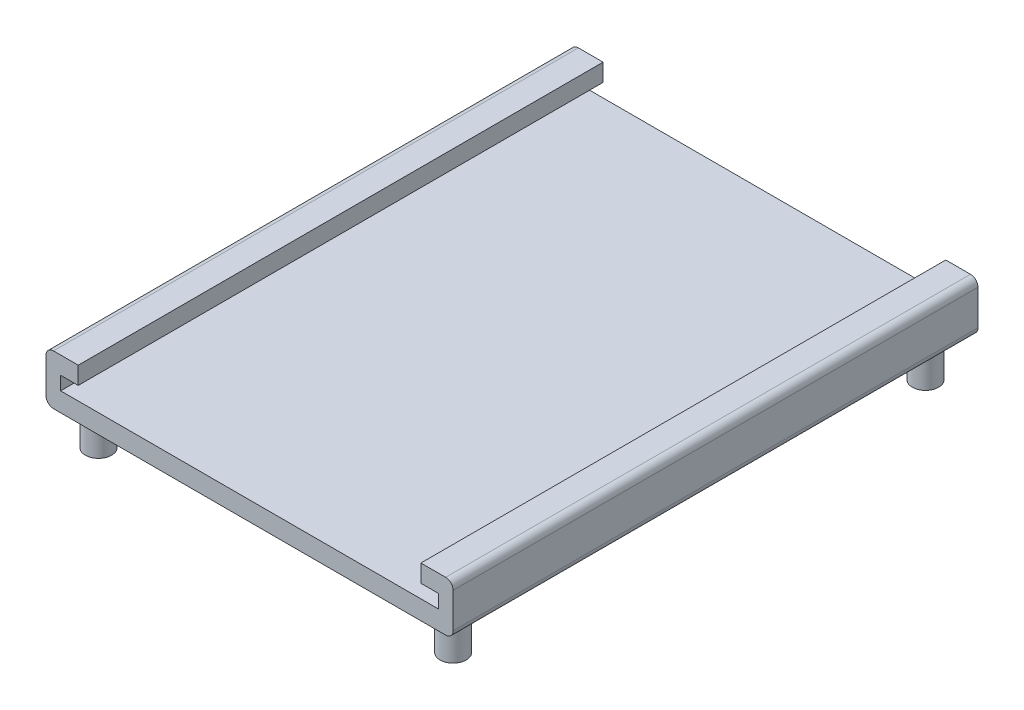
from build123d import *

# Parameters (mm, degrees)
SKETCH1_W             = 50
SKETCH1_H             = 70
BOSS_EXTRUDE1_DEPTH   = 2.54
SKETCH2_W             = 2.15
SKETCH2_H             = 70
BOSS_EXTRUDE2_DEPTH   = 2.54
BOSS_EXTRUDE2_2_DEPTH = 2.54
SKETCH4_W             = 2.15
SKETCH4_H             = 6.68
BOSS_EXTRUDE3_DEPTH   = 70
CUT_EXTRUDE1_DEPTH    = 1123.066858808
SKETCH8_R             = 1.75
BOSS_EXTRUDE4_DEPTH   = 5
FILLET4_R             = 1


with BuildPart() as part:
    # Sketch1 → Boss-Extrude1 (new body)
    with BuildSketch(Plane.XZ.offset(-868.135910235)):
        with Locations((675.180956215, 1301.572260588)):
            Rectangle(SKETCH1_W, SKETCH1_H)
    extrude(amount=BOSS_EXTRUDE1_DEPTH)



with BuildPart() as body_2:
    # Sketch2 → Boss-Extrude2 (new body)
    with BuildSketch(Plane(origin=(0, 869.735910235, 0), x_dir=(1, 0, 0), z_dir=(0, 1, 0))):
        with Locations((651.255956215, -1301.572260588)):
            Rectangle(SKETCH2_W, SKETCH2_H)
    extrude(amount=BOSS_EXTRUDE2_DEPTH)


with BuildPart() as body_3:
    # Sketch2 → Boss-Extrude2 2 (new body)
    with BuildSketch(Plane(origin=(0, 869.735910235, 0), x_dir=(1, 0, 0), z_dir=(0, 1, 0))):
        with Locations((699.105956215, -1301.572260588)):
            Rectangle(SKETCH2_W, SKETCH2_H)
    extrude(amount=BOSS_EXTRUDE2_2_DEPTH)


with BuildPart() as part_1:
    add(part.part)

    add(body_2.part)  # Boss-Extrude3 merges body 2

    add(body_3.part)  # Boss-Extrude3 merges body 3
    # Sketch4 → Boss-Extrude3 (add)
    with BuildSketch(Plane.XY.offset(1336.572260588)):
        with Locations((649.105956215, 868.935910235)):
            Rectangle(SKETCH4_W, SKETCH4_H)
        with Locations((701.255956215, 868.935910235)):
            Rectangle(SKETCH4_W, SKETCH4_H)
    extrude(amount=-BOSS_EXTRUDE3_DEPTH)

    # Sketch6 → Cut-Extrude1 (cut, through all)
    with BuildSketch(Plane(origin=(0, 0, 1266.572260588), x_dir=(-1, 0, 0), z_dir=(0, 0, -1))):
        Polygon((-698.030956215, 869.735910235), (-698.030956215, 868.135910235), (-700.380956215, 868.135910235), (-700.380956215, 869.935910235), (-698.030956215, 869.935910235), align=None)
        Polygon((-652.330956215, 869.935910235), (-652.330956215, 869.735910235), (-652.330956215, 868.135910235), (-649.980956215, 868.135910235), (-649.980956215, 869.935910235), align=None)
    extrude(amount=-CUT_EXTRUDE1_DEPTH, mode=Mode.SUBTRACT)

    # Sketch8 → Boss-Extrude4 (add)
    with BuildSketch(Plane.XZ.offset(-865.595910235)):
        with Locations(Location((651.530956215, 1333.072260588, 0), (0, 0, 180))):
            Circle(SKETCH8_R)
        with Locations(Location((698.830956215, 1333.072260588, 0), (0, 0, 180))):
            Circle(SKETCH8_R)
        with Locations(Location((698.830956215, 1270.072260588, 0), (0, 0, 180))):
            Circle(SKETCH8_R)
        with Locations(Location((651.530956215, 1270.072260588, 0), (0, 0, 180))):
            Circle(SKETCH8_R)
    extrude(amount=BOSS_EXTRUDE4_DEPTH)

    # Fillet4
    fillet4_edges = [part_1.edges().sort_by_distance(p)[0] for p in [
        (702.330956215, 865.595910235, 1301.572260588),
        (702.330956215, 872.275910235, 1301.572260588),
        (648.030956215, 865.595910235, 1301.572260588),
        (648.030956215, 872.275910235, 1301.572260588),
    ]]
    fillet(fillet4_edges, radius=FILLET4_R)


solid = part_1.part
